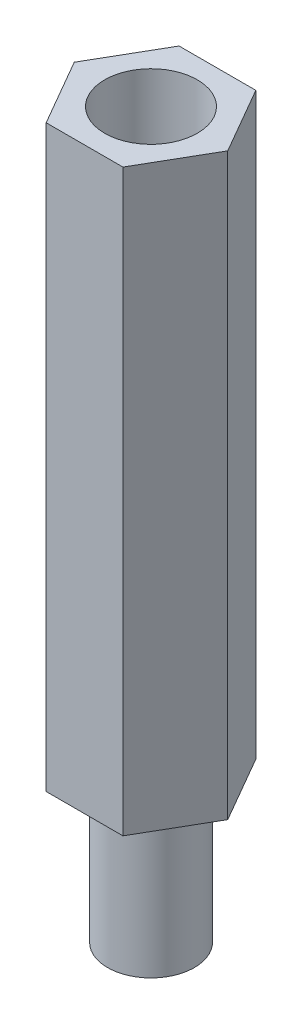
from build123d import *

# Parameters (mm, degrees)
BOSS_EXTRUDE1_DEPTH = 20
SKETCH2_R           = 1.6
CUT_EXTRUDE1_DEPTH  = 5
SKETCH3_R           = 1.5
BOSS_EXTRUDE2_DEPTH = 5


with BuildPart() as part:
    # Sketch1 → Boss-Extrude1 (new body)
    with BuildSketch(Plane(origin=(0, 0, 0), x_dir=(1, 0, 0), z_dir=(0, 1, 0))):
        Polygon((2.65, 0), (1.325, 2.29496732), (-1.325, 2.29496732), (-2.65, 0), (-1.325, -2.29496732), (1.325, -2.29496732), align=None)
    extrude(amount=BOSS_EXTRUDE1_DEPTH)

    # Sketch2 → Cut-Extrude1 (cut)
    with BuildSketch(Plane(origin=(0, 20, 0), x_dir=(1, 0, 0), z_dir=(0, 1, 0))):
        with Locations(Location((0, 0, 0), (0, 0, 270))):
            Circle(SKETCH2_R)
    extrude(amount=-CUT_EXTRUDE1_DEPTH, mode=Mode.SUBTRACT)

    # Sketch3 → Boss-Extrude2 (add)
    with BuildSketch(Plane.XZ):
        with Locations(Location((0, 0, 0), (0, 0, 270))):
            Circle(SKETCH3_R)
    extrude(amount=BOSS_EXTRUDE2_DEPTH)


solid = part.part
